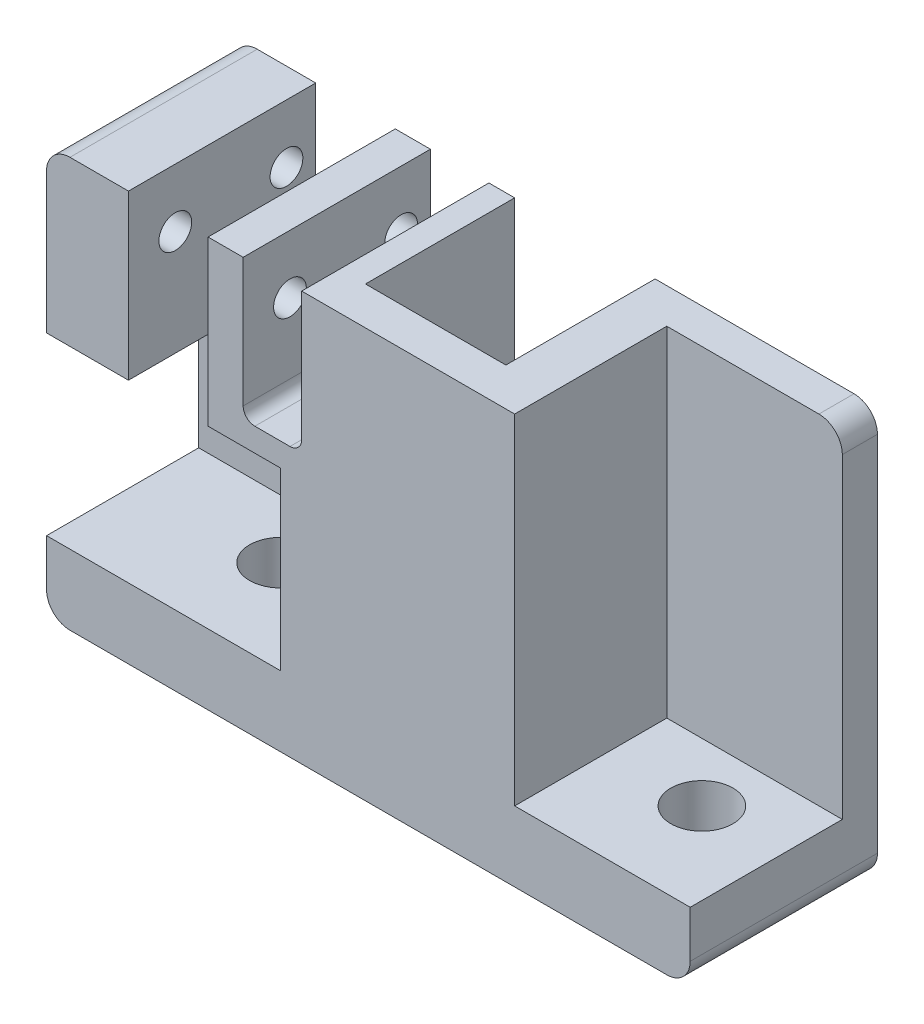
from build123d import *

# Parameters (mm, degrees)
SKETCH_1_W               = 55
SKETCH_1_H               = 35
EXTRUDE_1_DEPTH          = 16
SKETCH_3_R               = 2.65
CUT_EXTRUDE_2_DEPTH      = 13
SKETCH_4_W               = 12
SKETCH_4_H               = 12.75
CUT_EXTRUDE_3_DEPTH      = 68.126745787
FILLET_1_R               = 2
CUT_EXTRUDE_9_DEPTH      = 68.126745787
CUT_EXTRUDE_9_DEPTH_BACK = 18
SKETCH_11_R              = 1.4
SKETCH_12_W              = 6.8
SKETCH_12_H              = 16
CUT_EXTRUDE_10_DEPTH     = 68.126745787
SKETCH_13_W              = 15
SKETCH_13_H              = 15
SKETCH_13_W_2            = 20
CUT_EXTRUDE_12_DEPTH     = 13
SKETCH_15_W              = 20.5473163
SKETCH_15_H              = 18.952912532
CUT_EXTRUDE_13_DEPTH     = 13
SKETCH_16_W              = 5
SKETCH_16_H              = 16
CUT_EXTRUDE_14_DEPTH     = 12
FILLET_3_R               = 1


with BuildPart() as part:
    # 草图1 → 凸台-拉伸1 (new body)
    with BuildSketch(Plane.XY):
        with Locations((-27.5, 17.5)):
            Rectangle(SKETCH_1_W, SKETCH_1_H)
    extrude(amount=EXTRUDE_1_DEPTH)

    # 草图3 → 切除-拉伸2 (cut)
    with BuildSketch(Plane.XZ):
        with Locations(Location((-43, 8, 0), (0, 0, 270))):
            Circle(SKETCH_3_R)
        with Locations(Location((-7, 8, 0), (0, 0, 270))):
            Circle(SKETCH_3_R)
    extrude(amount=-CUT_EXTRUDE_2_DEPTH, mode=Mode.SUBTRACT)

    # 草图4 → 切除-拉伸3 (cut, through all)
    with BuildSketch(Plane.XZ):
        with Locations((-25, 6.375)):
            Rectangle(SKETCH_4_W, SKETCH_4_H)
    extrude(amount=-CUT_EXTRUDE_3_DEPTH, mode=Mode.SUBTRACT)

    # 圆角1
    fillet_1_edges = [part.edges().sort_by_distance(p)[0] for p in [
        (-55, 35, 8),
        (0, 35, 8),
        (0, 0, 8),
        (-55, 0, 8),
    ]]
    fillet(fillet_1_edges, radius=FILLET_1_R)

    # 草图11 → 切除-拉伸9 (cut, two sides: drawn at the far end of the back side and taken through both)
    with BuildSketch(Plane.ZY.offset(55).offset(-CUT_EXTRUDE_9_DEPTH_BACK)):
        with Locations(Location((12, 30, 0), (0, 0, 90))):
            Circle(SKETCH_11_R)
        with Locations(Location((2.5, 30, 0), (0, 0, 90))):
            Circle(SKETCH_11_R)
    extrude(amount=CUT_EXTRUDE_9_DEPTH + CUT_EXTRUDE_9_DEPTH_BACK, mode=Mode.SUBTRACT)

    # 草图12 → 切除-拉伸10 (cut, through all)
    with BuildSketch(Plane.XY.offset(16)):
        with Locations((-44.6, 27)):
            Rectangle(SKETCH_12_W, SKETCH_12_H)
    extrude(amount=-CUT_EXTRUDE_10_DEPTH, mode=Mode.SUBTRACT)

    # 草图13 → 切除-拉伸12 (cut)
    with BuildSketch(Plane.XY.offset(16)):
        with Locations((-7.5, 13.5)):
            Rectangle(SKETCH_13_W, SKETCH_13_H)
        with Locations((-45, 13.5)):
            Rectangle(SKETCH_13_W_2, SKETCH_13_H)
    extrude(amount=-CUT_EXTRUDE_12_DEPTH, mode=Mode.SUBTRACT)

    # 草图15 → 切除-拉伸13 (cut)
    with BuildSketch(Plane.XY.offset(16)):
        with Locations((-4.72634185, 30.476456266)):
            Rectangle(SKETCH_15_W, SKETCH_15_H)
    extrude(amount=-CUT_EXTRUDE_13_DEPTH, mode=Mode.SUBTRACT)

    # 草图16 → 切除-拉伸14 (cut)
    with BuildSketch(Plane(origin=(0, 35, 0), x_dir=(1, 0, 0), z_dir=(0, 1, 0))):
        with Locations((-35.7, -8)):
            Rectangle(SKETCH_16_W, SKETCH_16_H)
    extrude(amount=-CUT_EXTRUDE_14_DEPTH, mode=Mode.SUBTRACT)

    # 圆角3
    fillet_3_edges = [part.edges().sort_by_distance(p)[0] for p in [
        (-38.2, 23, 8),
        (-33.2, 23, 8),
        (-48, 19, 1.5),
        (-41.2, 19, 1.5),
    ]]
    fillet(fillet_3_edges, radius=FILLET_3_R)


solid = part.part
